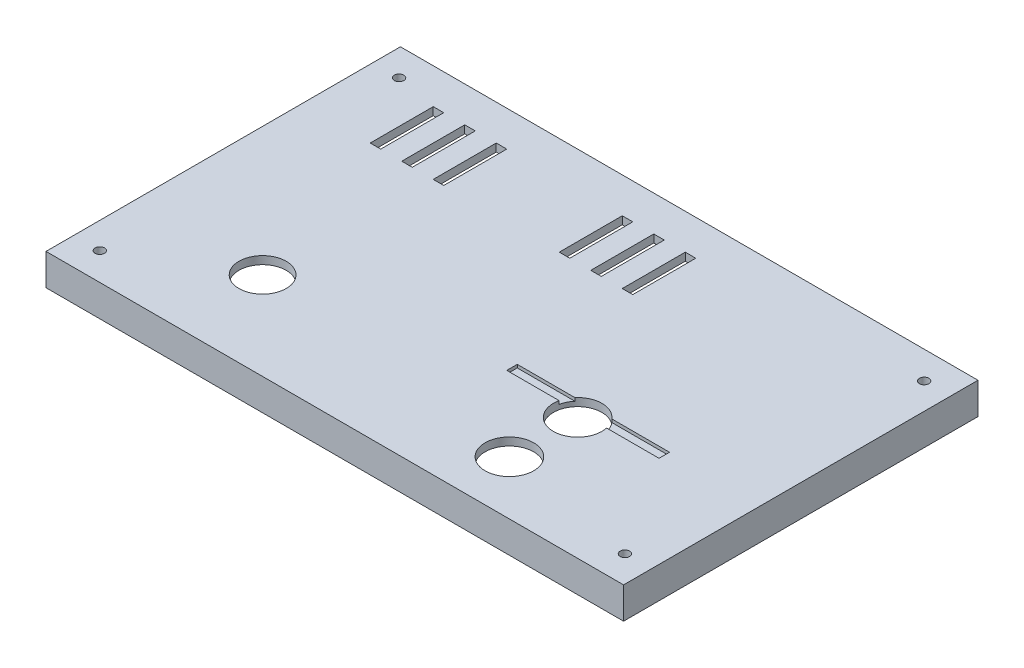
from build123d import *

# Parameters (mm, degrees)
SKETCH_1_W                       = 220
SKETCH_1_H                       = 135
LID_TOP_3MM_DEPTH                = 3
SKETCH_2_W                       = 216
SKETCH_2_H                       = 2
LID_RIM_BACK_DEPTH               = 12
SKETCH_3_W                       = 216
SKETCH_3_H                       = 2
LID_RIM_FRONT_DEPTH              = 12
SKETCH_4_W                       = 2
SKETCH_4_H                       = 135
LID_RIM_LEFT_DEPTH               = 12
SKETCH_5_W                       = 2
SKETCH_5_H                       = 135
LID_RIM_RIGHT_DEPTH              = 12
SKETCH_6_R                       = 1.8
LID_SCREW_CLEARANCE_1_DEPTH      = 16
SKETCH_7_R                       = 1.8
LID_SCREW_CLEARANCE_2_DEPTH      = 16
SKETCH_8_R                       = 1.8
LID_SCREW_CLEARANCE_3_DEPTH      = 16
SKETCH_9_R                       = 1.8
LID_SCREW_CLEARANCE_4_DEPTH      = 16
SKETCH_10_R                      = 9
OV5647_LENS_OPENING_D18_DEPTH    = 4
SKETCH_11_R                      = 9.25
HC_SR04_ACOUSTIC_OPENING_1_DEPTH = 4
SKETCH_12_R                      = 9.25
HC_SR04_ACOUSTIC_OPENING_2_DEPTH = 4
SKETCH_13_W                      = 58
SKETCH_13_H                      = 4
HC_SR04_ALIGNMENT_RECESS_DEPTH   = 1.2
SKETCH_14_W                      = 4
SKETCH_14_H                      = 24
VENT_SLOT_1_DEPTH                = 4
SKETCH_15_W                      = 4
SKETCH_15_H                      = 24
VENT_SLOT_2_DEPTH                = 4
SKETCH_16_W                      = 4
SKETCH_16_H                      = 24
VENT_SLOT_3_DEPTH                = 4
SKETCH_17_W                      = 4
SKETCH_17_H                      = 24
VENT_SLOT_4_DEPTH                = 4
SKETCH_18_W                      = 4
SKETCH_18_H                      = 24
VENT_SLOT_5_DEPTH                = 4
SKETCH_19_W                      = 4
SKETCH_19_H                      = 24
VENT_SLOT_6_DEPTH                = 4


with BuildPart() as part:
    # 草图1 → Lid_Top_3mm (new body)
    with BuildSketch(Plane(origin=(0, 0, 0), x_dir=(1, 0, 0), z_dir=(0, 1, 0))):
        Rectangle(SKETCH_1_W, SKETCH_1_H)
    extrude(amount=-LID_TOP_3MM_DEPTH)

    # 草图2 → Lid_Rim_Back (add)
    with BuildSketch(Plane(origin=(0, 0, 0), x_dir=(1, 0, 0), z_dir=(0, 1, 0))):
        with Locations((0, 66.5)):
            Rectangle(SKETCH_2_W, SKETCH_2_H)
    extrude(amount=-LID_RIM_BACK_DEPTH)

    # 草图3 → Lid_Rim_Front (add)
    with BuildSketch(Plane(origin=(0, 0, 0), x_dir=(1, 0, 0), z_dir=(0, 1, 0))):
        with Locations((0, -66.5)):
            Rectangle(SKETCH_3_W, SKETCH_3_H)
    extrude(amount=-LID_RIM_FRONT_DEPTH)

    # 草图4 → Lid_Rim_Left (add)
    with BuildSketch(Plane(origin=(0, 0, 0), x_dir=(1, 0, 0), z_dir=(0, 1, 0))):
        with Locations((-109, 0)):
            Rectangle(SKETCH_4_W, SKETCH_4_H)
    extrude(amount=-LID_RIM_LEFT_DEPTH)

    # 草图5 → Lid_Rim_Right (add)
    with BuildSketch(Plane(origin=(0, 0, 0), x_dir=(1, 0, 0), z_dir=(0, 1, 0))):
        with Locations((109, 0)):
            Rectangle(SKETCH_5_W, SKETCH_5_H)
    extrude(amount=-LID_RIM_RIGHT_DEPTH)

    # 草图6 → Lid_Screw_Clearance_1 (cut)
    with BuildSketch(Plane(origin=(0, 0, 0), x_dir=(1, 0, 0), z_dir=(0, 1, 0))):
        with Locations(Location((-100, -57, 0), (0, 0, 270))):
            Circle(SKETCH_6_R)
    extrude(amount=-LID_SCREW_CLEARANCE_1_DEPTH, mode=Mode.SUBTRACT)

    # 草图7 → Lid_Screw_Clearance_2 (cut)
    with BuildSketch(Plane(origin=(0, 0, 0), x_dir=(1, 0, 0), z_dir=(0, 1, 0))):
        with Locations(Location((100, -57, 0), (0, 0, 270))):
            Circle(SKETCH_7_R)
    extrude(amount=-LID_SCREW_CLEARANCE_2_DEPTH, mode=Mode.SUBTRACT)

    # 草图8 → Lid_Screw_Clearance_3 (cut)
    with BuildSketch(Plane(origin=(0, 0, 0), x_dir=(1, 0, 0), z_dir=(0, 1, 0))):
        with Locations(Location((-100, 57, 0), (0, 0, 270))):
            Circle(SKETCH_8_R)
    extrude(amount=-LID_SCREW_CLEARANCE_3_DEPTH, mode=Mode.SUBTRACT)

    # 草图9 → Lid_Screw_Clearance_4 (cut)
    with BuildSketch(Plane(origin=(0, 0, 0), x_dir=(1, 0, 0), z_dir=(0, 1, 0))):
        with Locations(Location((100, 57, 0), (0, 0, 270))):
            Circle(SKETCH_9_R)
    extrude(amount=-LID_SCREW_CLEARANCE_4_DEPTH, mode=Mode.SUBTRACT)

    # 草图10 → OV5647_Lens_Opening_D18 (cut)
    with BuildSketch(Plane(origin=(0, 0, 0), x_dir=(1, 0, 0), z_dir=(0, 1, 0))):
        with Locations(Location((-61, -34, 0), (0, 0, 270))):
            Circle(SKETCH_10_R)
    extrude(amount=-OV5647_LENS_OPENING_D18_DEPTH, mode=Mode.SUBTRACT)

    # 草图11 → HC_SR04_Acoustic_Opening_1 (cut)
    with BuildSketch(Plane(origin=(0, 0, 0), x_dir=(1, 0, 0), z_dir=(0, 1, 0))):
        with Locations(Location((46, -47, 0), (0, 0, 270))):
            Circle(SKETCH_11_R)
    extrude(amount=-HC_SR04_ACOUSTIC_OPENING_1_DEPTH, mode=Mode.SUBTRACT)

    # 草图12 → HC_SR04_Acoustic_Opening_2 (cut)
    with BuildSketch(Plane(origin=(0, 0, 0), x_dir=(1, 0, 0), z_dir=(0, 1, 0))):
        with Locations(Location((46, -21, 0), (0, 0, 270))):
            Circle(SKETCH_12_R)
    extrude(amount=-HC_SR04_ACOUSTIC_OPENING_2_DEPTH, mode=Mode.SUBTRACT)

    # 草图13 → HC_SR04_Alignment_Recess (cut)
    with BuildSketch(Plane(origin=(0, 0, 0), x_dir=(1, 0, 0), z_dir=(0, 1, 0))):
        with Locations((46, -17)):
            Rectangle(SKETCH_13_W, SKETCH_13_H)
    extrude(amount=-HC_SR04_ALIGNMENT_RECESS_DEPTH, mode=Mode.SUBTRACT)

    # 草图14 → Vent_Slot_1 (cut)
    with BuildSketch(Plane(origin=(0, 0, 0), x_dir=(1, 0, 0), z_dir=(0, 1, 0))):
        with Locations((-82, 42)):
            Rectangle(SKETCH_14_W, SKETCH_14_H)
    extrude(amount=-VENT_SLOT_1_DEPTH, mode=Mode.SUBTRACT)

    # 草图15 → Vent_Slot_2 (cut)
    with BuildSketch(Plane(origin=(0, 0, 0), x_dir=(1, 0, 0), z_dir=(0, 1, 0))):
        with Locations((-70, 42)):
            Rectangle(SKETCH_15_W, SKETCH_15_H)
    extrude(amount=-VENT_SLOT_2_DEPTH, mode=Mode.SUBTRACT)

    # 草图16 → Vent_Slot_3 (cut)
    with BuildSketch(Plane(origin=(0, 0, 0), x_dir=(1, 0, 0), z_dir=(0, 1, 0))):
        with Locations((-58, 42)):
            Rectangle(SKETCH_16_W, SKETCH_16_H)
    extrude(amount=-VENT_SLOT_3_DEPTH, mode=Mode.SUBTRACT)

    # 草图17 → Vent_Slot_4 (cut)
    with BuildSketch(Plane(origin=(0, 0, 0), x_dir=(1, 0, 0), z_dir=(0, 1, 0))):
        with Locations((-10, 42)):
            Rectangle(SKETCH_17_W, SKETCH_17_H)
    extrude(amount=-VENT_SLOT_4_DEPTH, mode=Mode.SUBTRACT)

    # 草图18 → Vent_Slot_5 (cut)
    with BuildSketch(Plane(origin=(0, 0, 0), x_dir=(1, 0, 0), z_dir=(0, 1, 0))):
        with Locations((2, 42)):
            Rectangle(SKETCH_18_W, SKETCH_18_H)
    extrude(amount=-VENT_SLOT_5_DEPTH, mode=Mode.SUBTRACT)

    # 草图19 → Vent_Slot_6 (cut)
    with BuildSketch(Plane(origin=(0, 0, 0), x_dir=(1, 0, 0), z_dir=(0, 1, 0))):
        with Locations((14, 42)):
            Rectangle(SKETCH_19_W, SKETCH_19_H)
    extrude(amount=-VENT_SLOT_6_DEPTH, mode=Mode.SUBTRACT)


solid = part.part
